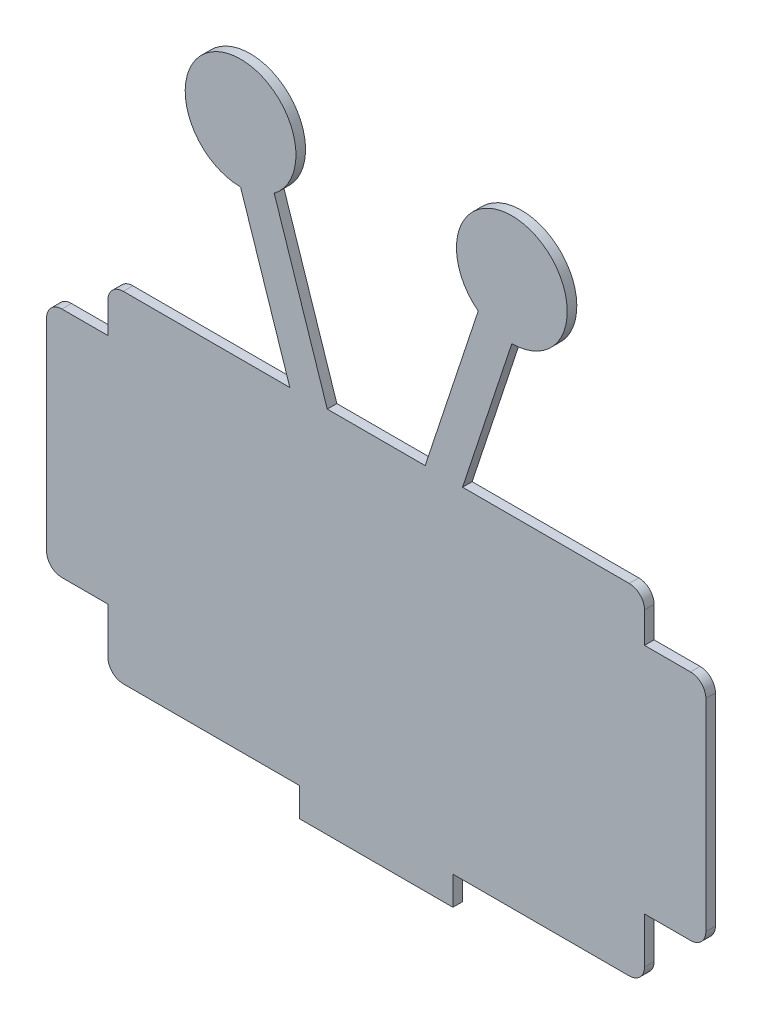
from build123d import *

# Parameters (mm, degrees)
BOSS_EXTRUDE1_DEPTH = 3.175


with BuildPart() as part:
    # Sketch1 → Boss-Extrude1 (new body)
    with BuildSketch(Plane.XY):
        with BuildLine():
            Line((0, -5.08), (58.42, -5.08))
            Line((58.42, -5.08), (58.42, -14.605))
            Line((58.42, -14.605), (109.22, -14.605))
            Line((109.22, -14.605), (109.22, -5.08))
            Line((109.22, -5.08), (167.64, -5.08))
            ThreePointArc((167.64, -5.08), (171.232102448, -3.592102448), (172.72, 0))
            Line((172.72, 0), (172.72, 15.24))
            Line((172.72, 15.24), (187.96, 15.24))
            ThreePointArc((187.96, 15.24), (191.552102448, 16.727897552), (193.04, 20.32))
            Line((193.04, 20.32), (193.04, 87.2236))
            ThreePointArc((193.04, 87.2236), (191.552102448, 90.815702448), (187.96, 92.3036))
            Line((187.96, 92.3036), (172.72, 92.3036))
            Line((172.72, 92.3036), (172.72, 102.4636))
            ThreePointArc((172.72, 102.4636), (171.232102448, 106.055702448), (167.64, 107.5436))
            Line((167.64, 107.5436), (112.428072163, 107.5436))
            Line((112.428072163, 107.5436), (128.760921922, 156.912121991))
            ThreePointArc((128.760921922, 156.912121991), (134.645312677, 192.644346081), (117.613615035, 160.685948618))
            Line((117.613615035, 160.685948618), (100.032250213, 107.5436))
            Line((100.032250213, 107.5436), (67.607749787, 107.5436))
            Line((67.607749787, 107.5436), (50.026384965, 160.685948618))
            ThreePointArc((50.026384965, 160.685948618), (32.994687323, 192.644346081), (38.879078078, 156.912121991))
            Line((38.879078078, 156.912121991), (55.211927837, 107.5436))
            Line((55.211927837, 107.5436), (0, 107.5436))
            ThreePointArc((0, 107.5436), (-3.592102448, 106.055702448), (-5.08, 102.4636))
            Line((-5.08, 102.4636), (-5.08, 92.3036))
            Line((-5.08, 92.3036), (-20.32, 92.3036))
            ThreePointArc((-20.32, 92.3036), (-23.912102448, 90.815702448), (-25.4, 87.2236))
            Line((-25.4, 87.2236), (-25.4, 20.32))
            ThreePointArc((-25.4, 20.32), (-23.912102448, 16.727897552), (-20.32, 15.24))
            Line((-20.32, 15.24), (-5.08, 15.24))
            Line((-5.08, 15.24), (-5.08, 0))
            ThreePointArc((-5.08, 0), (-3.592102448, -3.592102448), (0, -5.08))
        make_face()
    extrude(amount=BOSS_EXTRUDE1_DEPTH)


solid = part.part
